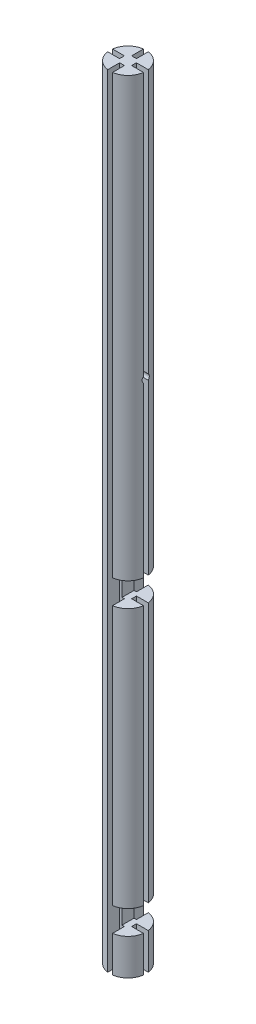
from build123d import *

# Parameters (mm, degrees)
BOSS_EXTRUDE2_DEPTH     = 4000
CUT_EXTRUDE1_START      = 200
SKETCH2_W               = 74.330343737
SKETCH2_H               = 151.048602177
CUT_EXTRUDE1_DEPTH      = 50
CUT_EXTRUDE2_START      = 1380
SKETCH2_2_W             = 74.330343737
SKETCH2_2_H             = 151.048602177
CUT_EXTRUDE2_DEPTH      = 50
SKETCH3_R               = 15.2
CUT_EXTRUDE3_DEPTH      = 49.330343737
SKETCH4_R               = 15.2
CUT_EXTRUDE4_DEPTH      = 49.330343737
CUT_EXTRUDE5_DEPTH      = 4002.923477282
CUT_EXTRUDE5_DEPTH_BACK = 4002.923477282
SKETCH5_W               = 148.660687474
SKETCH5_H               = 750


with BuildPart() as part:
    # Sketch1 → Boss-Extrude2 (new body)
    with BuildSketch(Plane(origin=(0, 0, 0), x_dir=(1, 0, 0), z_dir=(0, 1, 0))):
        with BuildLine():
            Line((-10, 74.330343737), (-10, 25))
            Line((-10, 25), (10, 25))
            Line((10, 25), (10, 74.330343737))
            ThreePointArc((10, 74.330343737), (53.033008589, 53.033008589), (74.330343737, 10))
            Line((74.330343737, 10), (25, 10))
            Line((25, 10), (25, -10))
            Line((25, -10), (74.330343737, -10))
            ThreePointArc((74.330343737, -10), (53.033008589, -53.033008589), (10, -74.330343737))
            Line((10, -74.330343737), (10, -25))
            Line((10, -25), (-10, -25))
            Line((-10, -25), (-10, -74.330343737))
            ThreePointArc((-10, -74.330343737), (-53.033008589, -53.033008589), (-74.330343737, -10))
            Line((-74.330343737, -10), (-25, -10))
            Line((-25, -10), (-25, 10))
            Line((-25, 10), (-74.330343737, 10))
            ThreePointArc((-74.330343737, 10), (-53.033008589, 53.033008589), (-10, 74.330343737))
        make_face()
    extrude(amount=BOSS_EXTRUDE2_DEPTH)

    # Sketch2 → Cut-Extrude1 (cut, symmetric)
    with BuildSketch(Plane(origin=(0, 0, 0), x_dir=(1, 0, 0), z_dir=(0, 1, 0)).offset(CUT_EXTRUDE1_START)):
        with Locations((37.165171869, -1.193957351)):
            Rectangle(SKETCH2_W, SKETCH2_H)
    extrude(amount=CUT_EXTRUDE1_DEPTH, both=True, mode=Mode.SUBTRACT)

    # Sketch2<2> → Cut-Extrude2 (cut, symmetric)
    with BuildSketch(Plane(origin=(0, 0, 0), x_dir=(1, 0, 0), z_dir=(0, 1, 0)).offset(CUT_EXTRUDE2_START)):
        with Locations((37.165171869, -1.193957351)):
            Rectangle(SKETCH2_2_W, SKETCH2_2_H)
    extrude(amount=CUT_EXTRUDE2_DEPTH, both=True, mode=Mode.SUBTRACT)

    # Sketch3 → Cut-Extrude3 (cut)
    with BuildSketch(Plane(origin=(74.330343737, 0, 0), x_dir=(0, 0, -1), z_dir=(1, 0, 0))):
        with Locations((0, 2143)):
            Circle(SKETCH3_R)
    extrude(amount=-CUT_EXTRUDE3_DEPTH, mode=Mode.SUBTRACT)

    # Sketch4 → Cut-Extrude4 (cut)
    with BuildSketch(Plane(origin=(0, 0, -74.330343737), x_dir=(-1, 0, 0), z_dir=(0, 0, -1))):
        with Locations((0, 2143)):
            Circle(SKETCH4_R)
    extrude(amount=-CUT_EXTRUDE4_DEPTH, mode=Mode.SUBTRACT)

    # Sketch5 → Cut-Extrude5 (cut, two sides: drawn at the far end of the back side and taken through both)
    with BuildSketch(Plane.XY.offset(25).offset(-CUT_EXTRUDE5_DEPTH_BACK)):
        with Locations((0, 3625)):
            Rectangle(SKETCH5_W, SKETCH5_H)
    extrude(amount=CUT_EXTRUDE5_DEPTH + CUT_EXTRUDE5_DEPTH_BACK, mode=Mode.SUBTRACT)


solid = part.part
